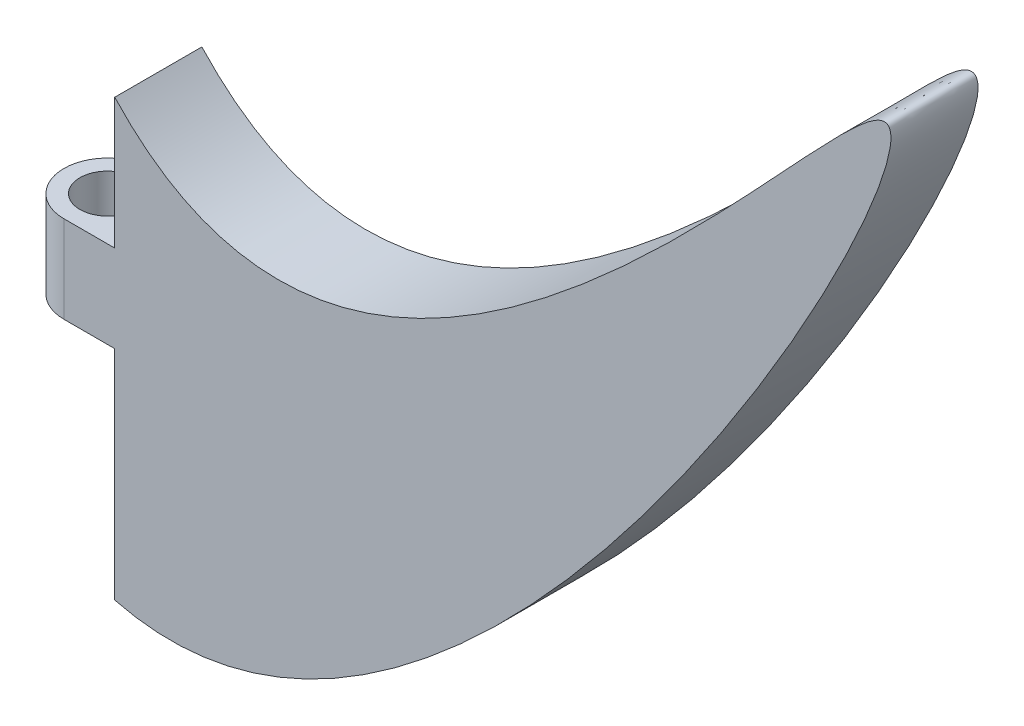
from build123d import *

# Parameters (mm, degrees)
SALIENTE_EXTRUIR1_DEPTH = 6
SALIENTE_EXTRUIR2_START = 15
SALIENTE_EXTRUIR2_DEPTH = 6
CROQUIS3_R              = 1.9
CORTAR_EXTRUIR1_DEPTH   = 6


with BuildPart() as part:
    # Croquis1 → Saliente-Extruir1 (new body)
    with BuildSketch(Plane.XY):
        with BuildLine():
            Line((0, 0), (0, 30))
            add(Edge.make_bspline(
                [(0, 0), (25.727362405, -6.618520464), (85.003269104, 107.781526991), (18.526346521, 9.99484145), (0, 30)],
                knots=[0, 0, 0, 0, 0.555968427, 1, 1, 1, 1], degree=3))
        make_face()
    extrude(amount=SALIENTE_EXTRUIR1_DEPTH)

    # Croquis2 → Saliente-Extruir2 (add)
    with BuildSketch(Plane(origin=(0, 0, 0), x_dir=(1, 0, 0), z_dir=(0, 1, 0)).offset(SALIENTE_EXTRUIR2_START)):
        with BuildLine():
            Line((0, 0), (-3.5, 0))
            ThreePointArc((-3.5, 0), (-6.5, -3), (-3.5, -6))
            Line((-3.5, -6), (0, -6))
            Line((0, -6), (0, 0))
        make_face()
    extrude(amount=SALIENTE_EXTRUIR2_DEPTH)

    # Croquis3 → Cortar-Extruir1 (cut)
    with BuildSketch(Plane(origin=(0, 21, 0), x_dir=(1, 0, 0), z_dir=(0, 1, 0))):
        with Locations(Location((-3.5, -3, 0), (0, 0, 270))):
            Circle(CROQUIS3_R)
    extrude(amount=-CORTAR_EXTRUIR1_DEPTH, mode=Mode.SUBTRACT)


solid = part.part
